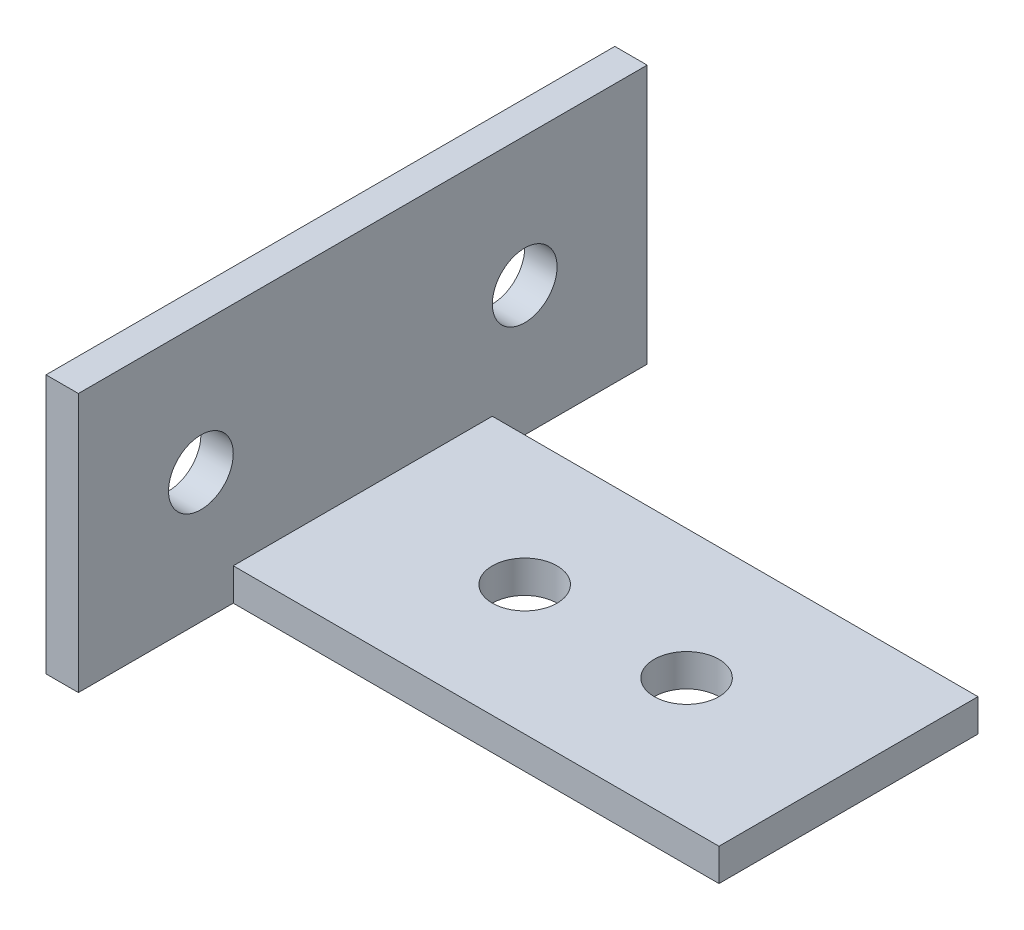
from build123d import *

# Parameters (mm, degrees)
BOSS_EXTRUDE3_DEPTH = 3.175
SKETCH3_W           = 12.7
SKETCH3_H           = 3.175
BOSS_EXTRUDE4_DEPTH = 47.625
SKETCH4_R           = 3.175
CUT_EXTRUDE1_DEPTH  = 16.256


with BuildPart() as part:
    # Sketch1 → Boss-Extrude3 (new body)
    with BuildSketch(Plane(origin=(0, 0, 0), x_dir=(0, 0, -1), z_dir=(1, 0, 0))):
        with BuildLine():
            ThreePointArc((-15.875, -3.175), (-18.12006403, 2.24506403), (-12.7, 0))
            Line((-12.7, 0), (0, 0))
            Line((0, 0), (0, 12.7))
            Line((0, 12.7), (-22.115038819, 12.7))
            Line((-22.115038819, 12.7), (-27.887655145, 12.7))
            Line((-27.887655145, 12.7), (-27.887655145, -12.7))
            Line((-27.887655145, -12.7), (-15.875, -12.7))
            Line((-15.875, -12.7), (-15.875, -3.175))
        make_face()
        with BuildLine():
            Line((0, 12.7), (0, 0))
            Line((0, 0), (12.7, 0))
            ThreePointArc((12.7, 0), (13.62993597, 2.24506403), (15.875, 3.175))
            Line((15.875, 3.175), (15.875, 12.7))
            Line((15.875, 12.7), (0, 12.7))
        make_face()
        with BuildLine():
            Line((0, 0), (-12.7, 0))
            ThreePointArc((-12.7, 0), (-13.62993597, -2.24506403), (-15.875, -3.175))
            Line((-15.875, -3.175), (-15.875, -12.7))
            Line((-15.875, -12.7), (22.115038819, -12.7))
            Line((22.115038819, -12.7), (27.887655145, -12.7))
            Line((27.887655145, -12.7), (27.887655145, 12.7))
            Line((27.887655145, 12.7), (15.875, 12.7))
            Line((15.875, 12.7), (15.875, 3.175))
            ThreePointArc((15.875, 3.175), (18.12006403, 2.24506403), (19.05, 0))
            ThreePointArc((19.05, 0), (15.875, -3.175), (12.7, 0))
            Line((12.7, 0), (0, 0))
        make_face()
    extrude(amount=BOSS_EXTRUDE3_DEPTH)

    # Sketch3 → Boss-Extrude4 (add)
    with BuildSketch(Plane(origin=(3.175, 0, 0), x_dir=(0, 0, -1), z_dir=(1, 0, 0))):
        with Locations((-6.35, -11.1125)):
            Rectangle(SKETCH3_W, SKETCH3_H)
        with Locations((6.35, -11.1125)):
            Rectangle(SKETCH3_W, SKETCH3_H)
    extrude(amount=BOSS_EXTRUDE4_DEPTH)

    # Sketch4 → Cut-Extrude1 (cut)
    with BuildSketch(Plane(origin=(0, -9.525, 0), x_dir=(1, 0, 0), z_dir=(0, 1, 0))):
        with Locations(Location((19.05, 0, 0), (0, 0, 270))):
            Circle(SKETCH4_R)
        with Locations(Location((34.925, 0, 0), (0, 0, 270))):
            Circle(SKETCH4_R)
    extrude(amount=-CUT_EXTRUDE1_DEPTH, mode=Mode.SUBTRACT)


solid = part.part
